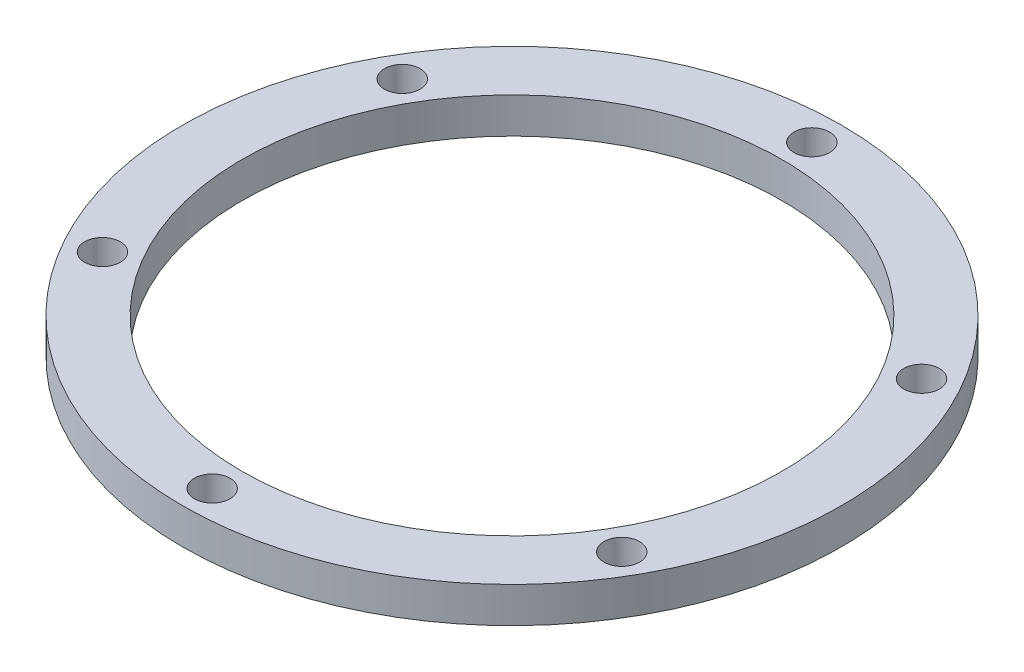
from build123d import *

# Parameters (mm, degrees)
SKETCH1_R           = 27.7
SKETCH1_R_2         = 22.7
SKETCH1_R_3         = 1.5
BOSS_EXTRUDE1_DEPTH = 3


with BuildPart() as part:
    # Sketch1 → Boss-Extrude1 (new body)
    with BuildSketch(Plane(origin=(0, 0, 0), x_dir=(1, 0, 0), z_dir=(0, 1, 0))):
        with Locations(Location((0, 0, 0), (0, 0, 270))):
            Circle(SKETCH1_R)
        with Locations(Location((0, 0, 0), (0, 0, 270))):
            Circle(SKETCH1_R_2, mode=Mode.SUBTRACT)
        with Locations(Location((0, 25.2, 0), (0, 0, 270))):
            Circle(SKETCH1_R_3, mode=Mode.SUBTRACT)
        with Locations(Location((21.823840175, 12.6, 0), (0, 0, 270))):
            Circle(SKETCH1_R_3, mode=Mode.SUBTRACT)
        with Locations(Location((21.823840175, -12.6, 0), (0, 0, 270))):
            Circle(SKETCH1_R_3, mode=Mode.SUBTRACT)
        with Locations(Location((0, -25.2, 0), (0, 0, 270))):
            Circle(SKETCH1_R_3, mode=Mode.SUBTRACT)
        with Locations(Location((-21.823840175, -12.6, 0), (0, 0, 270))):
            Circle(SKETCH1_R_3, mode=Mode.SUBTRACT)
        with Locations(Location((-21.823840175, 12.6, 0), (0, 0, 270))):
            Circle(SKETCH1_R_3, mode=Mode.SUBTRACT)
    extrude(amount=BOSS_EXTRUDE1_DEPTH)


solid = part.part
